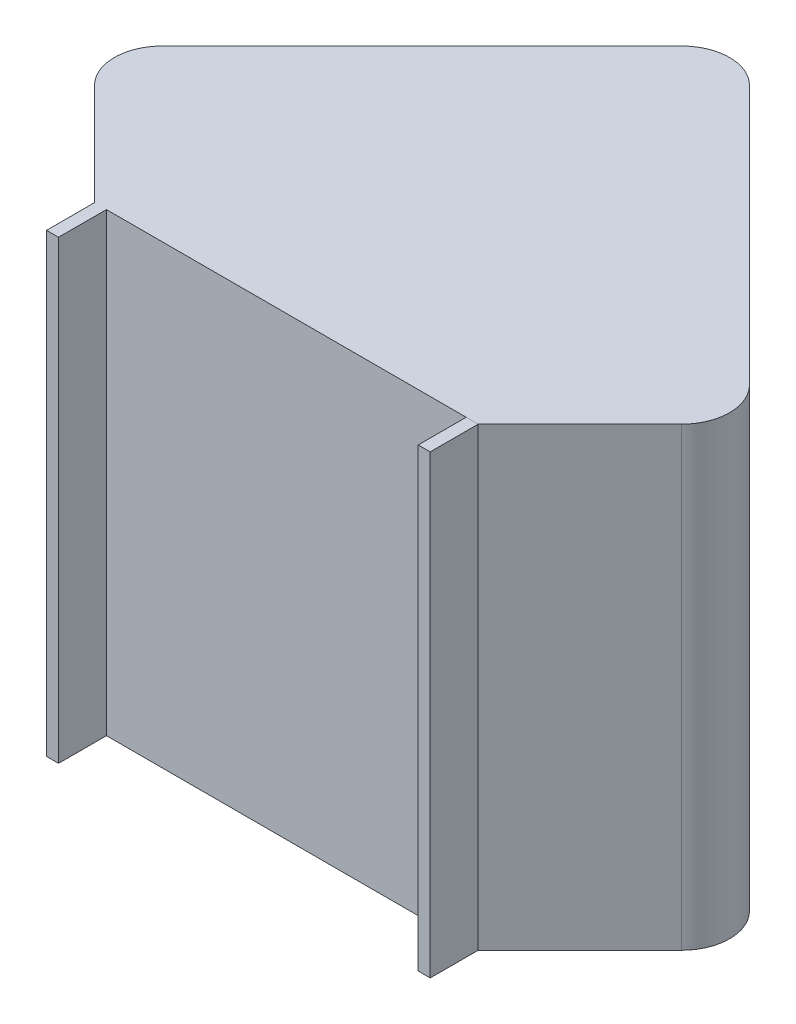
from build123d import *

# Parameters (mm, degrees)
SKETCH6_W             = 6.35
SKETCH6_H             = 25.4
BOSS_EXTRUDE1_DEPTH   = 241.3
BOSS_EXTRUDE1_2_DEPTH = 241.3
BOSS_EXTRUDE2_DEPTH   = 241.3
FILLET2_R             = 25.4
FILLET3_R             = 25.4
FILLET4_R             = 25.4


with BuildPart() as part:
    # Sketch6 → Boss-Extrude1 (new body)
    with BuildSketch(Plane.XZ):
        with Locations((-200.025, 12.7)):
            Rectangle(SKETCH6_W, SKETCH6_H)
    extrude(amount=-BOSS_EXTRUDE1_DEPTH)

    # Sketch10 → Boss-Extrude2 (add)
    with BuildSketch(Plane(origin=(0, 0, 0), x_dir=(1, 0, 0), z_dir=(0, 1, 0))):
        Polygon((0, 0), (-203.2, 0), (-275.042048969, 71.842048969), (-101.6, 245.284097937), (71.842048969, 71.842048969), align=None)
    extrude(amount=BOSS_EXTRUDE2_DEPTH)

    # Fillet2
    fillet2_edges = [part.edges().sort_by_distance(p)[0] for p in [
        (-101.6, 120.65, -245.284097937),
    ]]
    fillet(fillet2_edges, radius=FILLET2_R)

    # Fillet3
    fillet3_edges = [part.edges().sort_by_distance(p)[0] for p in [
        (-275.042048969, 120.65, -71.842048969),
    ]]
    fillet(fillet3_edges, radius=FILLET3_R)

    # Fillet4
    fillet4_edges = [part.edges().sort_by_distance(p)[0] for p in [
        (71.842048969, 120.65, -71.842048969),
    ]]
    fillet(fillet4_edges, radius=FILLET4_R)


with BuildPart() as body_2:
    # Sketch6 → Boss-Extrude1 2 (new body)
    with BuildSketch(Plane.XZ):
        with Locations((-3.175, 12.7)):
            Rectangle(SKETCH6_W, SKETCH6_H)
    extrude(amount=-BOSS_EXTRUDE1_2_DEPTH)


solid = Compound([part.part, body_2.part])
